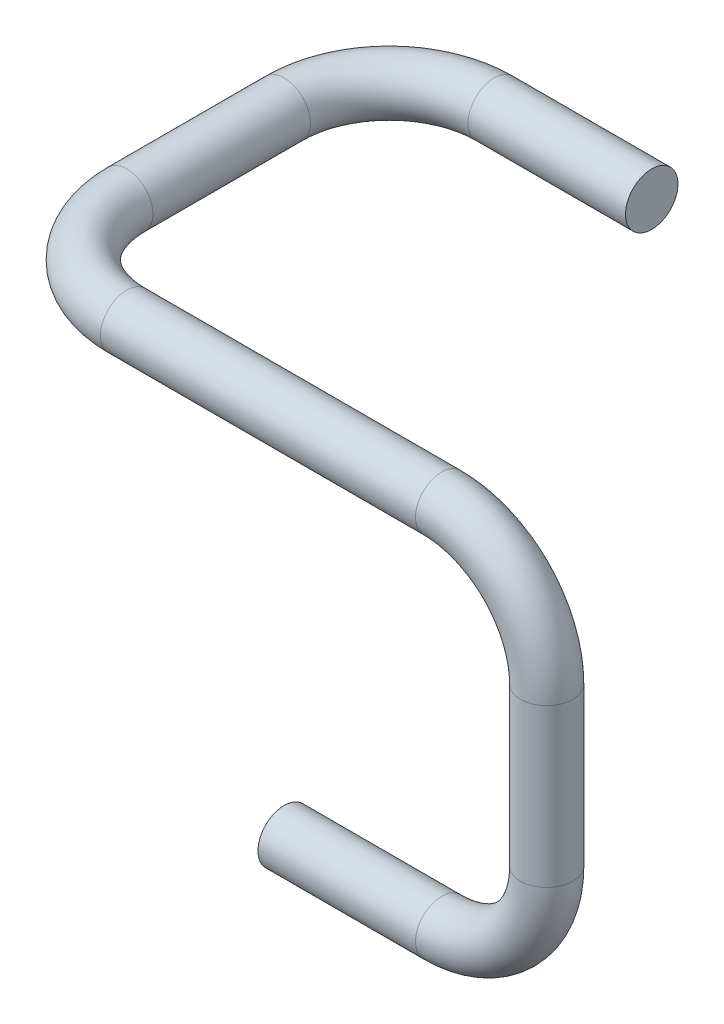
from build123d import *

# Parameters (mm, degrees)
SWEEP1_PROFILE_R = 0.5


with BuildPart() as part:
    # Sweep1: sweep along a curve in space
    with BuildLine() as sweep1_path:
        Line((2, 0, -3.5), (5, 0, -3.5))
        ThreePointArc((0, 0, -1.5), (0.585786438, 0, -2.914213562), (2, 0, -3.5))
        Line((0, 0, -1.5), (0, 0, 1.5))
        ThreePointArc((0, 0, 1.5), (0.585786438, 0, 2.914213562), (2, 0, 3.5))
        Line((2, 0, 3.5), (8, 0, 3.5))
        ThreePointArc((8, 0, 3.5), (9.414213562, -0.585786438, 3.5), (10, -2, 3.5))
        Line((10, -2, 3.5), (10, -5, 3.5))
        ThreePointArc((10, -5, 3.5), (9.414213562, -6.414213562, 3.5), (8, -7, 3.5))
        Line((8, -7, 3.5), (5, -7, 3.5))
    # Sweep1 profile (on start of the path) → Sweep1 (sweep)
    with BuildSketch(Plane(origin=(5, -7, 3.5), x_dir=(0, 0, 1), z_dir=(1, 0, 0))):
        Circle(SWEEP1_PROFILE_R)
    sweep(path=sweep1_path.line)


solid = part.part
